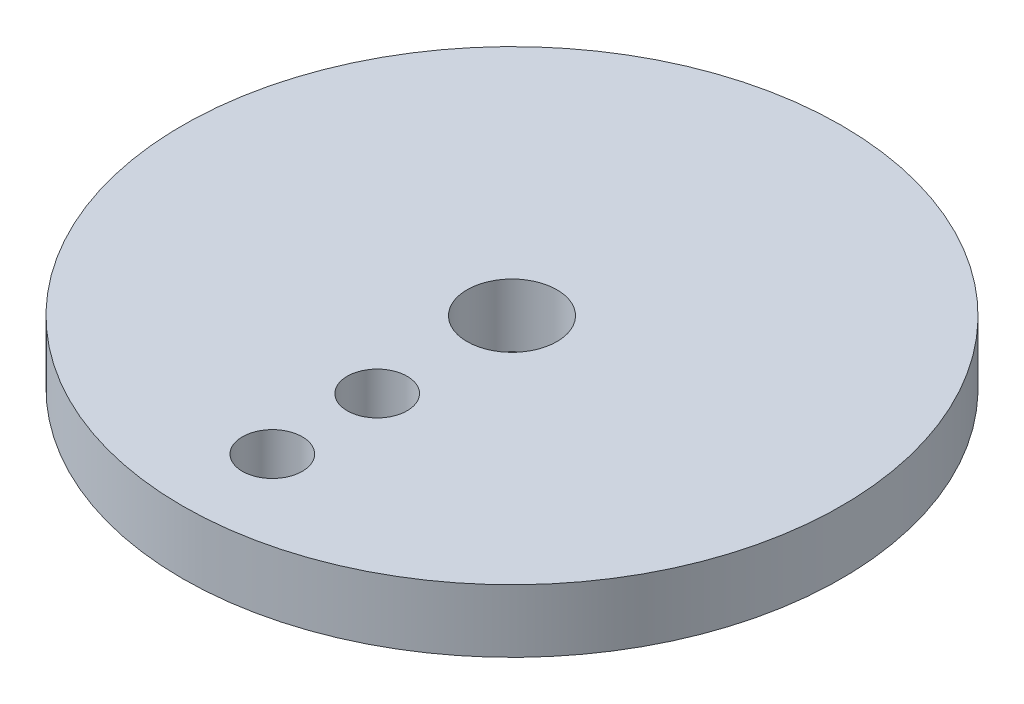
from build123d import *

# Parameters (mm, degrees)
SKETCH2_R           = 11
SKETCH2_R_2         = 1.5
SKETCH2_R_3         = 1
BOSS_EXTRUDE1_DEPTH = 2.1


with BuildPart() as part:
    # Sketch2 → Boss-Extrude1 (new body)
    with BuildSketch(Plane(origin=(0, 0, 0), x_dir=(1, 0, 0), z_dir=(0, 1, 0))):
        with Locations(Location((0, 11.5, 0), (0, 0, 270))):
            Circle(SKETCH2_R)
        with Locations(Location((0, 11.5, 0), (0, 0, 270))):
            Circle(SKETCH2_R_2, mode=Mode.SUBTRACT)
        with Locations(Location((0, 3.5, 0), (0, 0, 270))):
            Circle(SKETCH2_R_3, mode=Mode.SUBTRACT)
        with Locations(Location((0, 7, 0), (0, 0, 270))):
            Circle(SKETCH2_R_3, mode=Mode.SUBTRACT)
    extrude(amount=BOSS_EXTRUDE1_DEPTH)


solid = part.part
